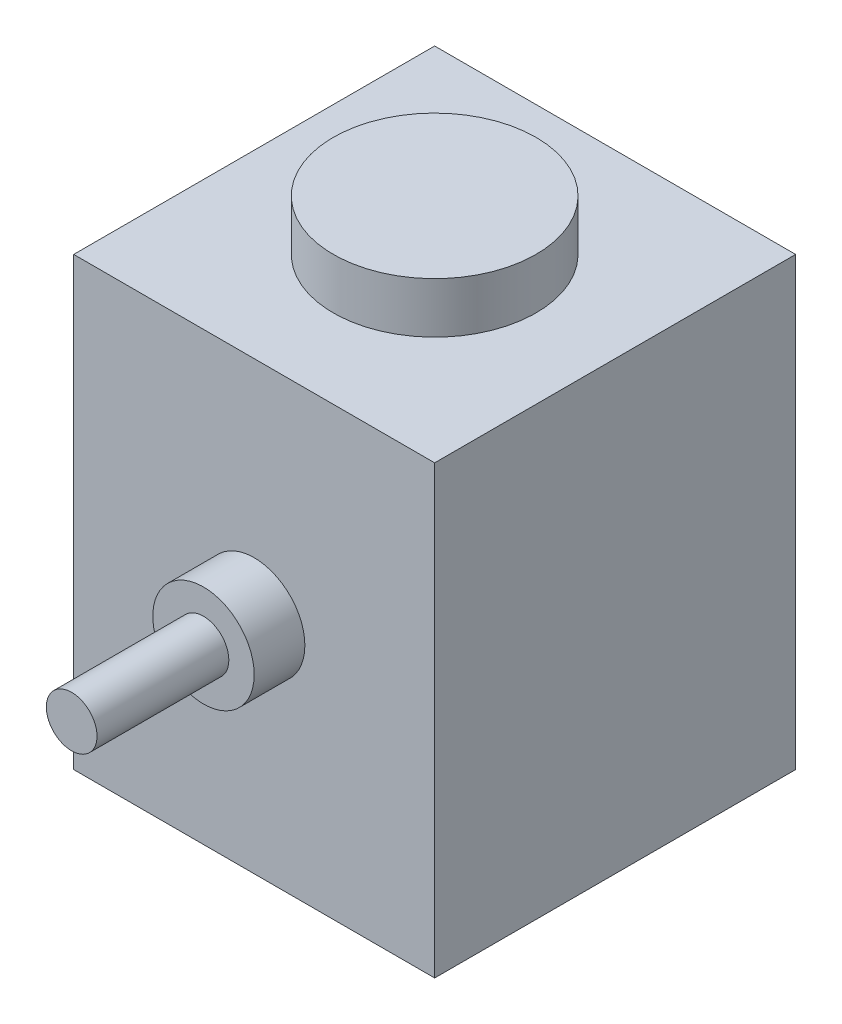
from build123d import *

# Parameters (mm, degrees)
BOSS_EXTRUDE1_DEPTH      = 22.606
BOSS_EXTRUDE1_DEPTH_BACK = 22.606
SKETCH1_5_W              = 6.35
SKETCH1_5_H              = 35.306
SKETCH2_R                = 3.175
BOSS_EXTRUDE2_DEPTH      = 22.86
SKETCH2_3_R              = 6.35
SKETCH2_3_R_2            = 3.175
BOSS_EXTRUDE3_DEPTH      = 6.35


with BuildPart() as part:
    # Sketch1 → Boss-Extrude1 (new, two sides: drawn at the far end of the back side and taken through both)
    with BuildSketch(Plane.YZ.offset(-BOSS_EXTRUDE1_DEPTH_BACK)):
        Polygon((6.35, 9.906), (6.35, 0), (62.23, 0), (62.23, 9.906), (68.58, 9.906), (68.58, 35.306), (62.23, 35.306), (62.23, 45.212), (6.35, 45.212), (6.35, 35.306), (0, 35.306), (0, 9.906), align=None)
    extrude(amount=BOSS_EXTRUDE1_DEPTH + BOSS_EXTRUDE1_DEPTH_BACK)

    # Sketch1<5> → Cut-Revolve3 (revolve, cut)
    with BuildSketch(Plane.YZ):
        with Locations((3.175, 52.959)):
            Rectangle(SKETCH1_5_W, SKETCH1_5_H)
        with Locations((65.405, 52.959)):
            Rectangle(SKETCH1_5_W, SKETCH1_5_H)
    revolve(axis=Axis((0, 6.35, 22.606), (0, 1, 0)), mode=Mode.SUBTRACT)

    # Sketch2 → Boss-Extrude2 (add)
    with BuildSketch(Plane.XY.offset(45.212)):
        with Locations((0, 34.29)):
            Circle(SKETCH2_R)
    extrude(amount=BOSS_EXTRUDE2_DEPTH)

    # Sketch2<3> → Boss-Extrude3 (add)
    with BuildSketch(Plane.XY.offset(45.212)):
        with Locations((0, 34.29)):
            Circle(SKETCH2_3_R)
        with Locations((0, 34.29)):
            Circle(SKETCH2_3_R_2, mode=Mode.SUBTRACT)
    extrude(amount=BOSS_EXTRUDE3_DEPTH)


solid = part.part
